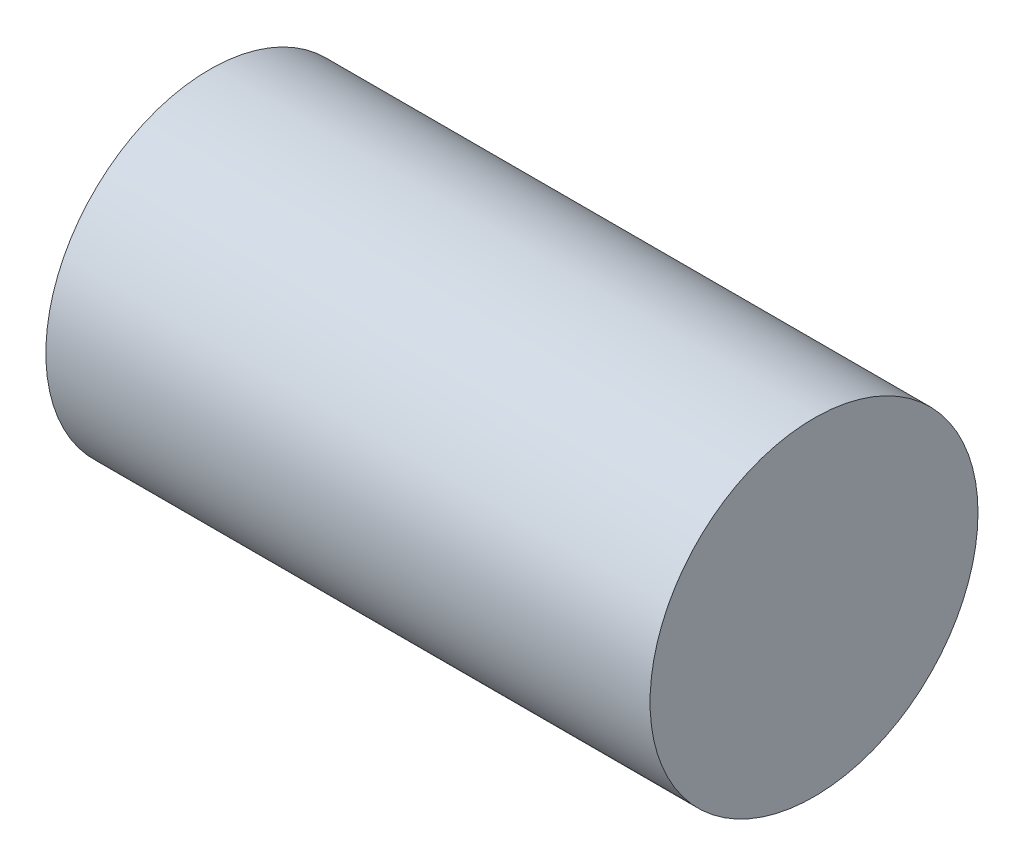
from build123d import *

# Parameters (mm, degrees)
SKETCH1_R           = 4.98
BOSS_EXTRUDE1_DEPTH = 18.35


with BuildPart() as part:
    # Sketch1 → Boss-Extrude1 (new body)
    with BuildSketch(Plane.YZ):
        with Locations(Location((0, 0, 0), (0, 0, 270))):
            Circle(SKETCH1_R)
    extrude(amount=BOSS_EXTRUDE1_DEPTH)


solid = part.part
